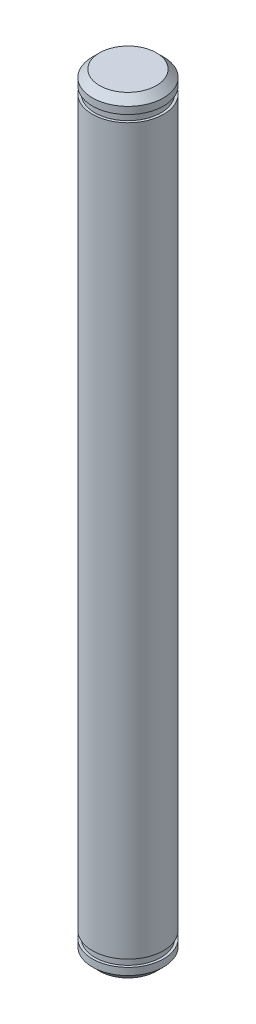
from build123d import *

# Parameters (mm, degrees)
CHAMFER_1_SIZE      = 1
CUT_EXTRUDE_START   = -3
SKETCH_2_R          = 5
SKETCH_2_R_2        = 4.65
CUT_EXTRUDE_1_DEPTH = 1


with BuildPart() as part:
    # 草图1 → 旋转1 (revolve)
    with BuildSketch(Plane.XY, mode=Mode.PRIVATE) as revolve_1_sk:
        Polygon((0, 54), (5, 54), (5, 30), (5, -30), (5, -54), (0, -54), align=None)
    revolve(revolve_1_sk.sketch.rotate(Axis((0, 54, 0), (0, -1, 0)), 180), axis=Axis((0, 54, 0), (0, -1, 0)))

    # 倒角1
    chamfer_1_edges = [part.edges().sort_by_distance(p)[0] for p in [
        (5, -54, 0),
        (5, 54, 0),
    ]]
    chamfer(chamfer_1_edges, length=CHAMFER_1_SIZE)

    # 草图2 → 切除-拉伸1 (cut)
    with BuildSketch(Plane(origin=(0, 54, 0), x_dir=(1, 0, 0), z_dir=(0, 1, 0)).offset(CUT_EXTRUDE_START)):
        with Locations(Location((0, 0, 0), (0, 0, 180))):
            Circle(SKETCH_2_R)
        with Locations(Location((0, 0, 0), (0, 0, 180))):
            Circle(SKETCH_2_R_2, mode=Mode.SUBTRACT)
    cut_extrude_1 = extrude(amount=CUT_EXTRUDE_1_DEPTH, mode=Mode.SUBTRACT)

    # 镜向1: 切除-拉伸1 across plane
    add(cut_extrude_1.mirror(Plane.ZX), mode=Mode.SUBTRACT)


solid = part.part
